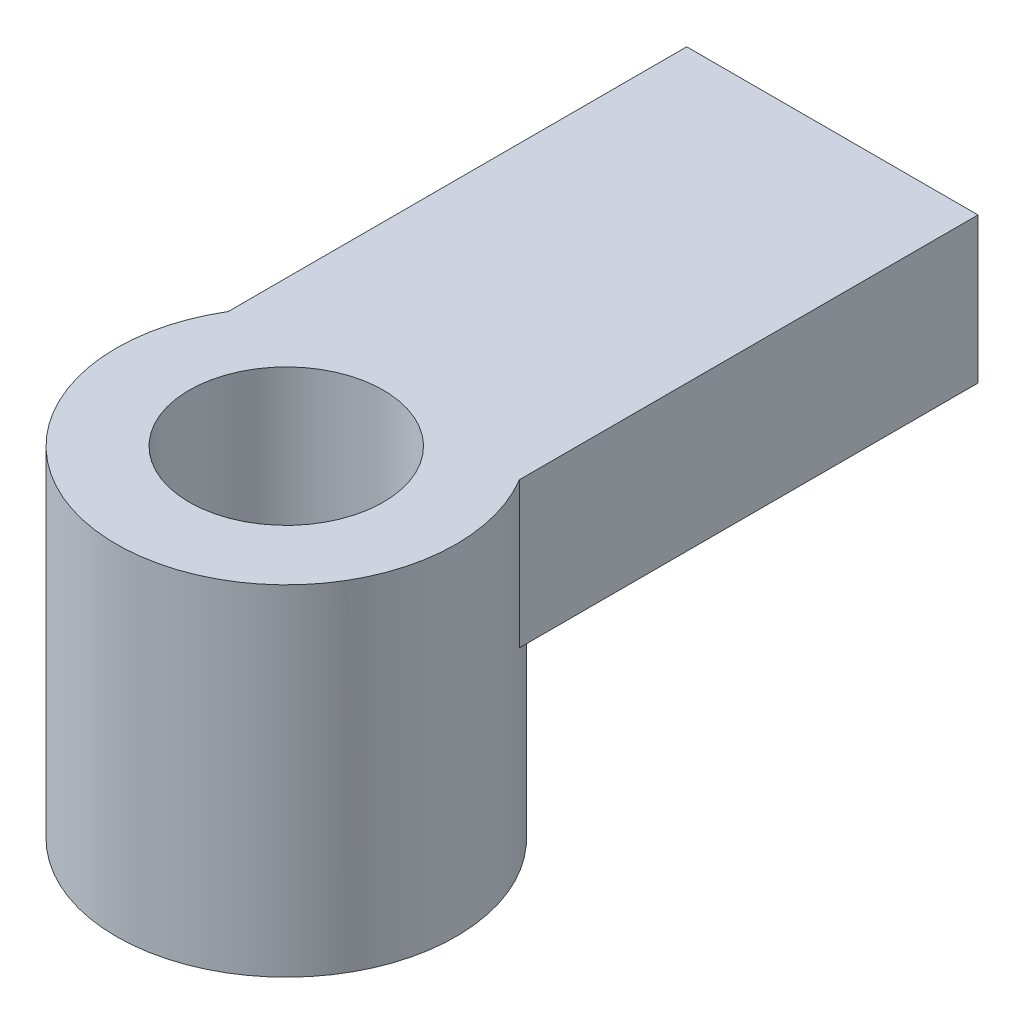
from build123d import *

# Parameters (mm, degrees)
SKETCH1_R           = 28
SKETCH1_R_2         = 16
BOSS_EXTRUDE1_DEPTH = 56
BOSS_EXTRUDE2_START = -24
BOSS_EXTRUDE2_DEPTH = 24
SKETCH5_R           = 16
CUT_EXTRUDE2_DEPTH  = 40


with BuildPart() as part:
    # Sketch1 → Boss-Extrude1 (new body)
    with BuildSketch(Plane(origin=(0, 0, 0), x_dir=(1, 0, 0), z_dir=(0, 1, 0))):
        with Locations(Location((0, 0, 0), (0, 0, 270))):
            Circle(SKETCH1_R)
        with Locations(Location((0, 0, 0), (0, 0, 270))):
            Circle(SKETCH1_R_2, mode=Mode.SUBTRACT)
    extrude(amount=BOSS_EXTRUDE1_DEPTH)

    # Sketch3 → Boss-Extrude2 (add)
    with BuildSketch(Plane(origin=(0, 56, 0), x_dir=(1, 0, 0), z_dir=(0, 1, 0)).offset(BOSS_EXTRUDE2_START)):
        with BuildLine():
            Line((-24, 90), (24, 90))
            Line((24, 90), (24, 14.422205102))
            ThreePointArc((24, 14.422205102), (0, 28), (-24, 14.422205102))
            Line((-24, 14.422205102), (-24, 90))
        make_face()
    extrude(amount=BOSS_EXTRUDE2_DEPTH)

    # Sketch5 → Cut-Extrude2 (cut)
    with BuildSketch(Plane(origin=(0, 0, -90), x_dir=(-1, 0, 0), z_dir=(0, 0, -1))):
        with Locations((0, 32)):
            Circle(SKETCH5_R)
    extrude(amount=-CUT_EXTRUDE2_DEPTH, mode=Mode.SUBTRACT)


solid = part.part
